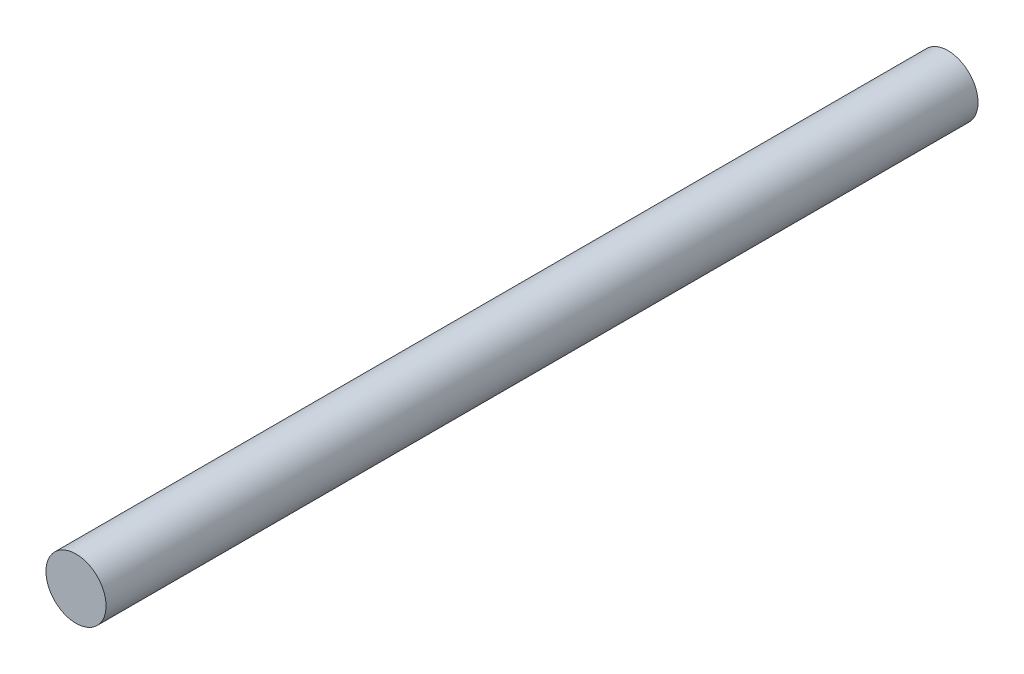
from build123d import *

# Parameters (mm, degrees)
SKETCH1_R           = 5
BOSS_EXTRUDE1_DEPTH = 72.5


with BuildPart() as part:
    # Sketch1 → Boss-Extrude1 (new, symmetric)
    with BuildSketch(Plane.XY):
        Circle(SKETCH1_R)
    extrude(amount=BOSS_EXTRUDE1_DEPTH, both=True)


solid = part.part
